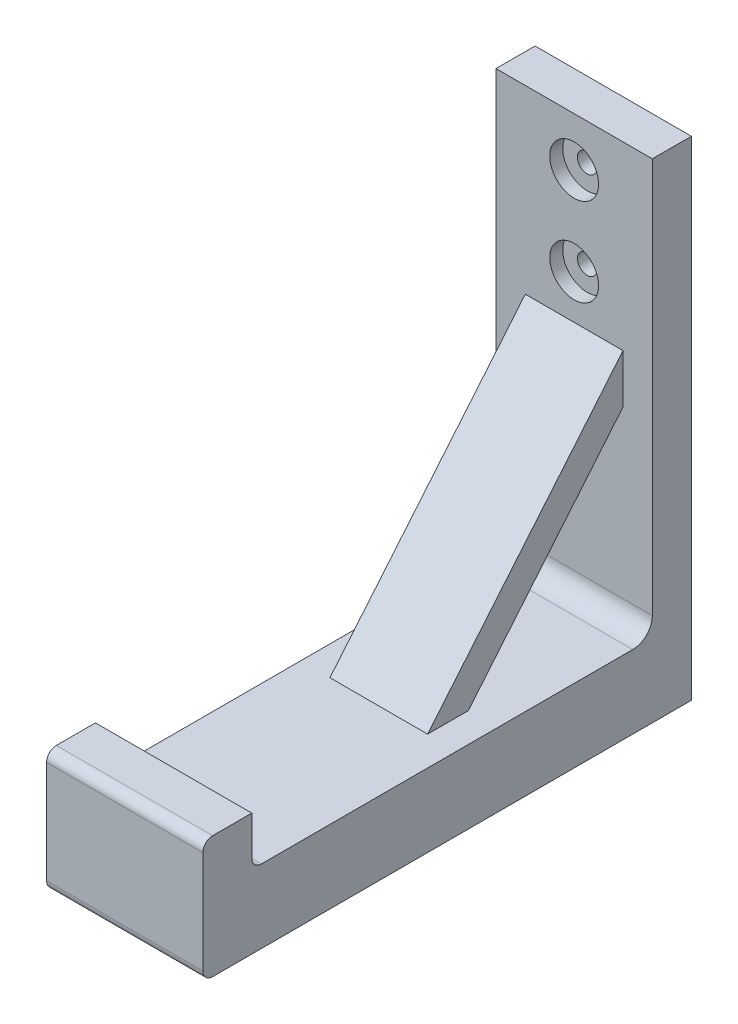
from build123d import *

# Parameters (mm, degrees)
BOSS_EXTRUDE1_DEPTH                              = 20.32
BOSS_EXTRUDE2_DEPTH                              = 12.7
CBORE_FOR_10_PAN_HEAD_MACHINE_SCREW1_D           = 5.08
CBORE_FOR_10_PAN_HEAD_MACHINE_SCREW1_CBORE_D     = 12.7
CBORE_FOR_10_PAN_HEAD_MACHINE_SCREW1_CBORE_DEPTH = 3.3782
FILLET1_R                                        = 5.08
FILLET2_R                                        = 2.54
FILLET3_R                                        = 2.54
FILLET4_R                                        = 2.54


with BuildPart() as part:
    # Sketch1 → Boss-Extrude1 (new, symmetric)
    with BuildSketch(Plane(origin=(0, 0, 0), x_dir=(0, 0, -1), z_dir=(1, 0, 0))):
        Polygon((0, 0), (0, 127), (-10.16, 127), (-10.16, 19.05), (-114.3, 19.05), (-114.3, 31.75), (-127, 31.75), (-127, 0), align=None)
    extrude(amount=BOSS_EXTRUDE1_DEPTH, both=True)

    # Sketch1<9> → Boss-Extrude2 (add, symmetric)
    with BuildSketch(Plane(origin=(0, 0, 0), x_dir=(0, 0, -1), z_dir=(1, 0, 0))):
        Polygon((-60.96, 19.05), (-10.16, 80.01), (-10.16, 67.31), (-50.376666667, 19.05), align=None)
    extrude(amount=BOSS_EXTRUDE2_DEPTH, both=True)

    # CBORE for #10 Pan Head Machine Screw1 (through all)
    with Locations(Plane.XY.offset(10.16)):
        with Locations((0, 91.44), (0, 114.3)):
            CounterBoreHole(CBORE_FOR_10_PAN_HEAD_MACHINE_SCREW1_D / 2, CBORE_FOR_10_PAN_HEAD_MACHINE_SCREW1_CBORE_D / 2, CBORE_FOR_10_PAN_HEAD_MACHINE_SCREW1_CBORE_DEPTH)

    # Fillet1
    fillet1_edges = [part.edges().sort_by_distance(p)[0] for p in [
        (0, 19.05, 10.16),
    ]]
    fillet(fillet1_edges, radius=FILLET1_R)

    # Fillet2
    fillet2_edges = [part.edges().sort_by_distance(p)[0] for p in [
        (0, 19.05, 114.3),
    ]]
    fillet(fillet2_edges, radius=FILLET2_R)

    # Fillet3
    fillet3_edges = [part.edges().sort_by_distance(p)[0] for p in [
        (0, 0, 127),
    ]]
    fillet(fillet3_edges, radius=FILLET3_R)

    # Fillet4
    fillet4_edges = [part.edges().sort_by_distance(p)[0] for p in [
        (0, 31.75, 127),
    ]]
    fillet(fillet4_edges, radius=FILLET4_R)


solid = part.part
